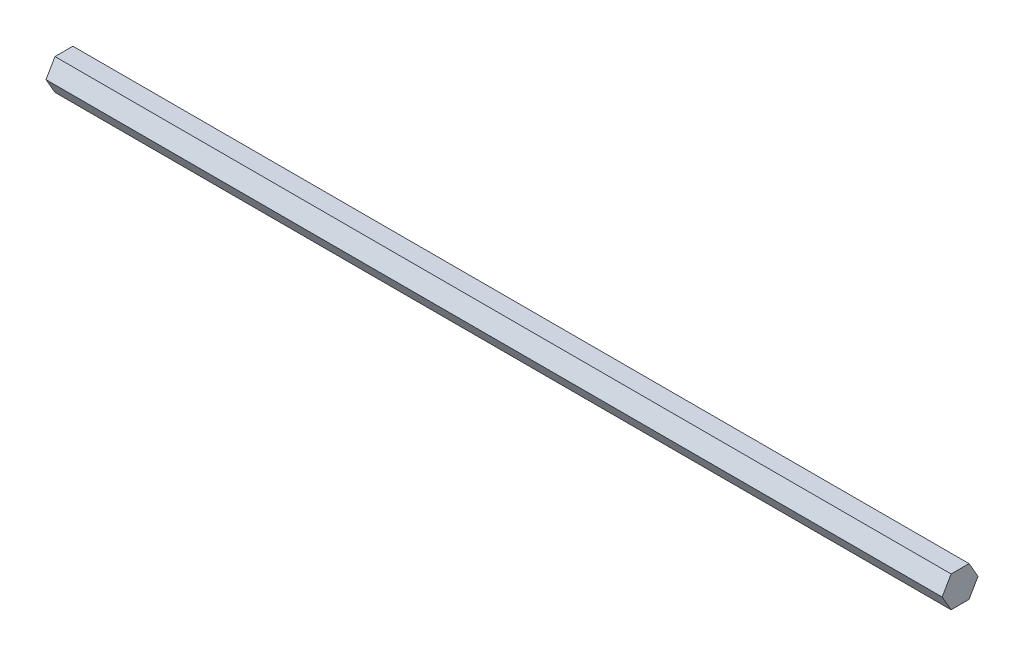
from build123d import *

# Parameters (mm, degrees)
BOSS_EXTRUDE1_DEPTH = 635


with BuildPart() as part:
    # Sketch2 → Boss-Extrude1 (new body)
    with BuildSketch(Plane(origin=(0, 0, 0), x_dir=(0, 0, -1), z_dir=(1, 0, 0))):
        Polygon((-6.351192816, 10.997833869), (-12.699999925, -0.001377388), (-6.34880711, -10.999211257), (6.351192816, -10.997833869), (12.699999925, 0.001377388), (6.34880711, 10.999211257), align=None)
    extrude(amount=BOSS_EXTRUDE1_DEPTH)


solid = part.part
